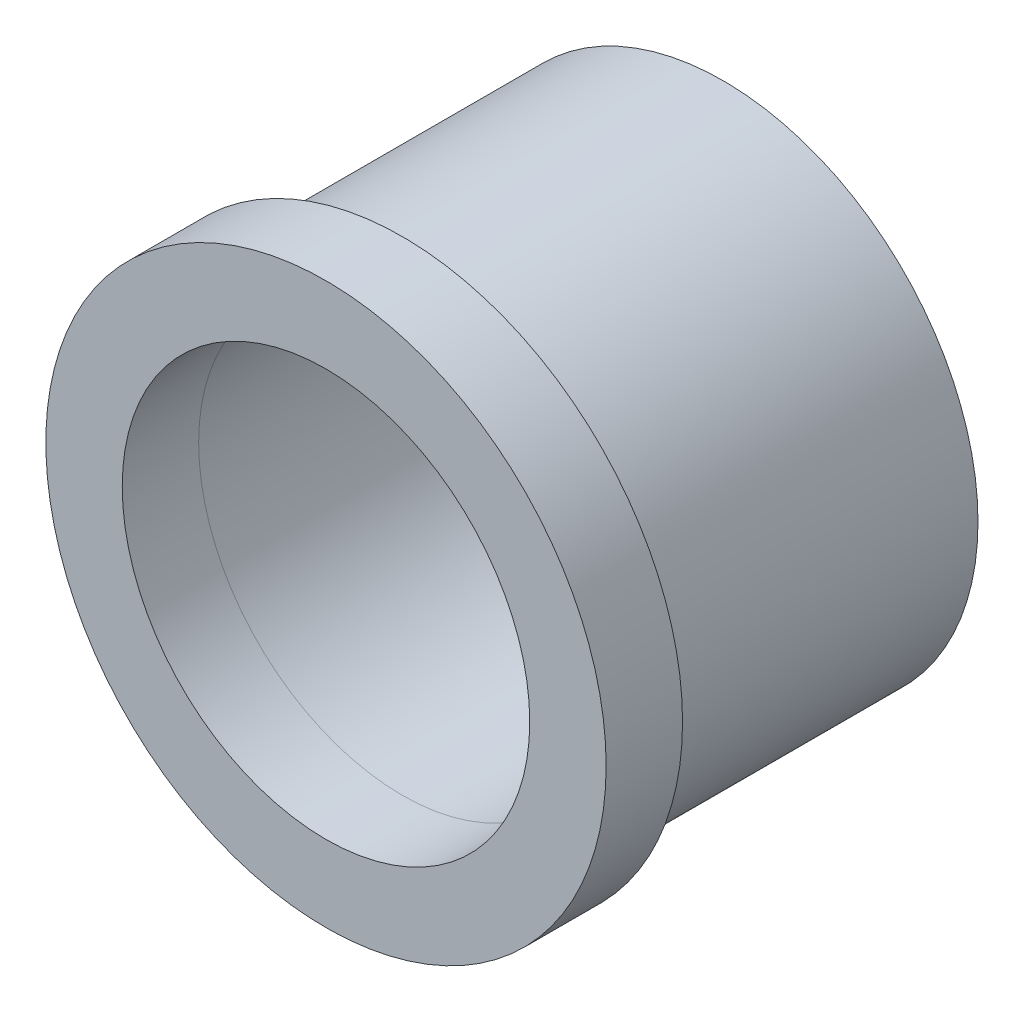
from build123d import *

# Parameters (mm, degrees)
ESQUISSE1_R        = 5
ESQUISSE1_R_2      = 4
BOSS_EXTRU_1_DEPTH = 6.3
ESQUISSE2_R        = 5.5
ESQUISSE2_R_2      = 4
BOSS_EXTRU_2_DEPTH = 1.5


with BuildPart() as part:
    # Esquisse1 → Boss.-Extru.1 (new body)
    with BuildSketch(Plane.XY):
        Circle(ESQUISSE1_R)
        Circle(ESQUISSE1_R_2, mode=Mode.SUBTRACT)
    extrude(amount=BOSS_EXTRU_1_DEPTH)


with BuildPart() as body_2:
    # Esquisse2 → Boss.-Extru.2 (new body)
    with BuildSketch(Plane.XY.offset(6.3)):
        Circle(ESQUISSE2_R)
        Circle(ESQUISSE2_R_2, mode=Mode.SUBTRACT)
    extrude(amount=BOSS_EXTRU_2_DEPTH)


solid = Compound([part.part, body_2.part])
